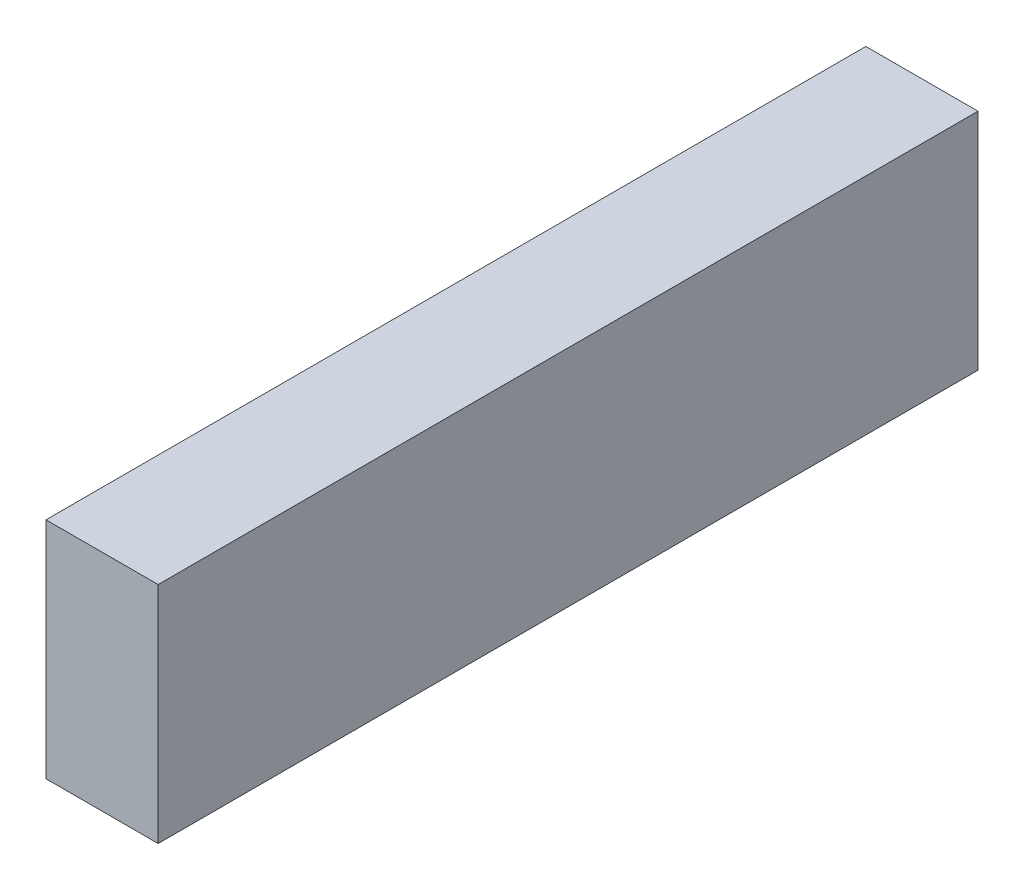
from build123d import *

# Parameters (mm, degrees)
SKETCH1_W           = 73.1
SKETCH1_H           = 20
BOSS_EXTRUDE1_DEPTH = 10


with BuildPart() as part:
    # Sketch1 → Boss-Extrude1 (new body)
    with BuildSketch(Plane(origin=(0, 0, 0), x_dir=(0, 0, -1), z_dir=(1, 0, 0))):
        with Locations((36.55, 10)):
            Rectangle(SKETCH1_W, SKETCH1_H)
    extrude(amount=BOSS_EXTRUDE1_DEPTH)


solid = part.part
